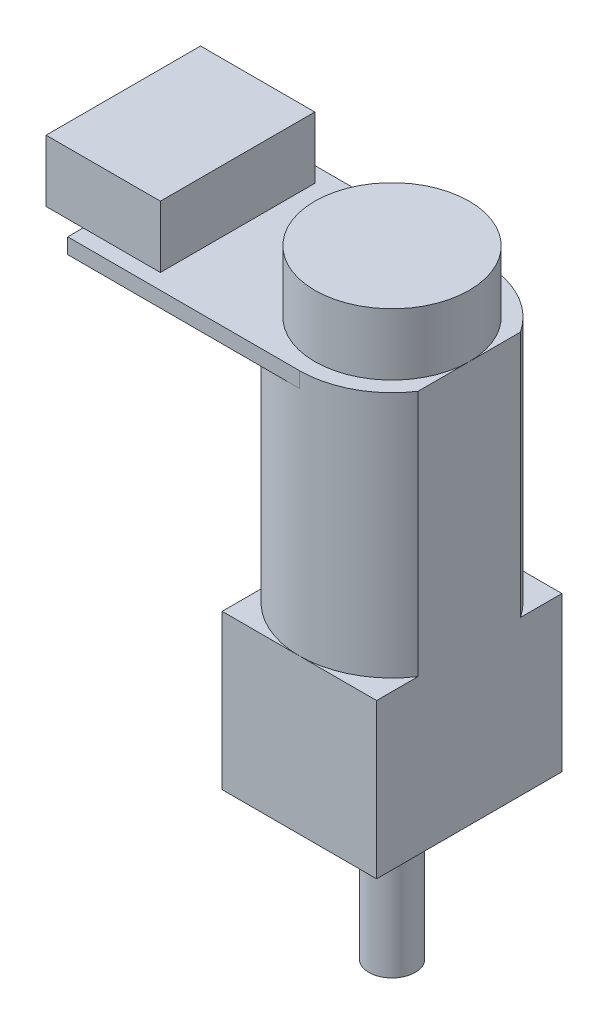
from build123d import *

# Parameters (mm, degrees)
SKETCH_1_R               = 6
EXTRUDE_1_DEPTH          = 15
SKETCH_2_OUTSIDE_W       = 18.53
SKETCH_2_OUTSIDE_H       = 18.53
SKETCH_2_OUTSIDE_W_2     = 10
SKETCH_2_OUTSIDE_H_2     = 17.562426414
CUT_EXTRUDE_1_DEPTH      = 15
EXTRUDE_2_DEPTH          = 1
SKETCH_4_W               = 10
SKETCH_4_H               = 12
EXTRUDE_3_DEPTH          = 10
SKETCH_5_R               = 1.5
EXTRUDE_4_DEPTH          = 10
SKETCH_6_W               = 6.926984356
SKETCH_6_H               = 2.009610912
CUT_EXTRUDE_2_DEPTH      = 10
SKETCH_7_R               = 5
EXTRUDE_5_DEPTH          = 4
SKETCH_8_W               = 7.4
SKETCH_8_H               = 10
EXTRUDE_6_DEPTH          = 4
HOLE_WIZARD_M1_4_1_D     = 1.6
HOLE_WIZARD_M1_4_1_DEPTH = 10
HOLE_WIZARD_M1_4_1_TIP   = 0.480688495
HOLE_WIZARD_M1_6_1_D     = 1.25
HOLE_WIZARD_M1_6_1_DEPTH = 4
HOLE_WIZARD_M1_6_1_TIP   = 0.375537887


with BuildPart() as part:
    # 草图1 → 凸台-拉伸1 (new body)
    with BuildSketch(Plane(origin=(0, 0, 0), x_dir=(1, 0, 0), z_dir=(0, 1, 0))):
        with Locations(Location((0, 0, 0), (0, 0, 270))):
            Circle(SKETCH_1_R)
    extrude(amount=EXTRUDE_1_DEPTH)

    # 草图2 outside → 切除-拉伸1 (cut)
    with BuildSketch(Plane(origin=(0, 15, 0), x_dir=(1, 0, 0), z_dir=(0, 1, 0))):
        Rectangle(SKETCH_2_OUTSIDE_W, SKETCH_2_OUTSIDE_H)
        Rectangle(SKETCH_2_OUTSIDE_W_2, SKETCH_2_OUTSIDE_H_2, mode=Mode.SUBTRACT)
    extrude(amount=-CUT_EXTRUDE_1_DEPTH, mode=Mode.SUBTRACT)

    # 草图3 → 凸台-拉伸2 (add)
    with BuildSketch(Plane(origin=(0, 15, 0), x_dir=(1, 0, 0), z_dir=(0, 1, 0))):
        with BuildLine():
            Line((0, -6), (-15, -6))
            Line((-15, -6), (-15, 6))
            Line((-15, 6), (0, 6))
            ThreePointArc((0, 6), (2.837274331, 5.286764074), (5, 3.31662479))
            Line((5, 3.31662479), (5, -3.31662479))
            ThreePointArc((5, -3.31662479), (2.837274331, -5.286764074), (0, -6))
        make_face()
    extrude(amount=EXTRUDE_2_DEPTH)

    # 草图4 → 凸台-拉伸3 (add)
    with BuildSketch(Plane.XZ):
        Rectangle(SKETCH_4_W, SKETCH_4_H)
    extrude(amount=EXTRUDE_3_DEPTH)

    # 草图5 → 凸台-拉伸4 (add)
    with BuildSketch(Plane.XZ.offset(10)):
        with Locations(Location((0, 0, 0), (0, 0, 270))):
            Circle(SKETCH_5_R)
    extrude(amount=EXTRUDE_4_DEPTH)

    # 草图6 → 切除-拉伸2 (cut)
    with BuildSketch(Plane.XZ.offset(20)):
        with Locations((0.466792476, -2.004805456)):
            Rectangle(SKETCH_6_W, SKETCH_6_H)
    extrude(amount=-CUT_EXTRUDE_2_DEPTH, mode=Mode.SUBTRACT)

    # 草图7 → 凸台-拉伸5 (add)
    with BuildSketch(Plane(origin=(0, 16, 0), x_dir=(1, 0, 0), z_dir=(0, 1, 0))):
        Circle(SKETCH_7_R)
    extrude(amount=EXTRUDE_5_DEPTH)

    # 草图8 → 凸台-拉伸6 (add)
    with BuildSketch(Plane(origin=(0, 16, 0), x_dir=(1, 0, 0), z_dir=(0, 1, 0))):
        with Locations((-13.7, 0)):
            Rectangle(SKETCH_8_W, SKETCH_8_H)
    extrude(amount=EXTRUDE_6_DEPTH)

    # M1.4 间隙孔1
    with Locations(Plane(origin=(0, -10, 0), x_dir=(-1, 0, 0), z_dir=(0, -1, 0))):
        with Locations((-2.5, 3.75), (2.5, -3.75)):
            Hole(HOLE_WIZARD_M1_4_1_D / 2, depth=HOLE_WIZARD_M1_4_1_DEPTH)
            with Locations((0, 0, -(HOLE_WIZARD_M1_4_1_DEPTH + HOLE_WIZARD_M1_4_1_TIP / 2))):  # 118° drill point
                Cone(0, HOLE_WIZARD_M1_4_1_D / 2, HOLE_WIZARD_M1_4_1_TIP, mode=Mode.SUBTRACT)

    # M1.6 螺纹孔1
    with Locations(Plane(origin=(0, -10, 0), x_dir=(-1, 0, 0), z_dir=(0, -1, 0))):
        with Locations((0, 5), (0, -5)):
            Hole(HOLE_WIZARD_M1_6_1_D / 2, depth=HOLE_WIZARD_M1_6_1_DEPTH)
            with Locations((0, 0, -(HOLE_WIZARD_M1_6_1_DEPTH + HOLE_WIZARD_M1_6_1_TIP / 2))):  # 118° drill point
                Cone(0, HOLE_WIZARD_M1_6_1_D / 2, HOLE_WIZARD_M1_6_1_TIP, mode=Mode.SUBTRACT)


solid = part.part
